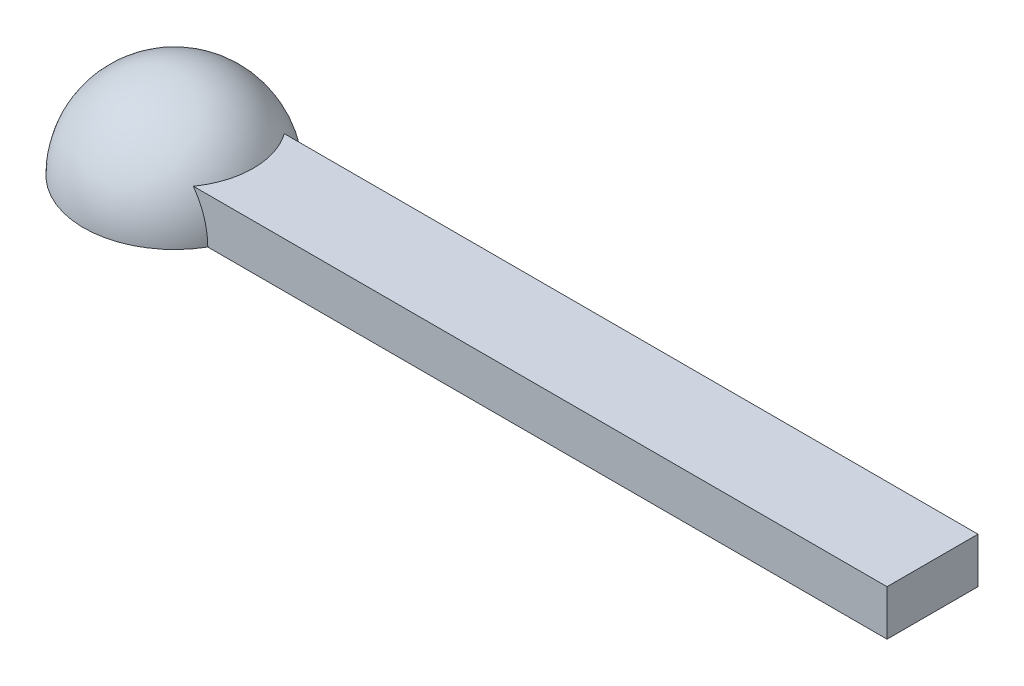
from build123d import *

# Parameters (mm, degrees)
REVOLVE1_ANGLE                  = 180
BOSS_EXTRUDE1_REACH             = 20.111
BOSS_EXTRUDE1_END_RADIUS        = 6
SKETCH2_W                       = 6
SKETCH2_H                       = 3
BOSS_EXTRUDE1_DIRECTION_2_DEPTH = 40


with BuildPart() as part:
    # Sketch1 → Revolve1 (revolve)
    with BuildSketch(Plane(origin=(0, 0, 0), x_dir=(1, 0, 0), z_dir=(0, 1, 0))):
        with BuildLine():
            Line((-6, 0), (-5, 0))
            ThreePointArc((-5, 0), (0, 5), (5, 0))
            Line((5, 0), (6, 0))
            ThreePointArc((6, 0), (0, 6), (-6, 0))
        make_face()
    revolve(axis=Axis((-6, 0, 0), (1, 0, 0)), revolution_arc=REVOLVE1_ANGLE)

    # Boss-Extrude1: up to this sphere (the profile starts outside it)
    boss_extrude1_end = Location((0, 0, 0)) * Sphere(BOSS_EXTRUDE1_END_RADIUS, mode=Mode.PRIVATE)
    # Sketch2 → Boss-Extrude1 (add, up to the surface)
    with BuildSketch(Plane(origin=(10, 0, 0), x_dir=(0, 0, -1), z_dir=(1, 0, 0)), mode=Mode.PRIVATE) as boss_extrude1_sk1:
        with Locations((0, 1.5)):
            Rectangle(SKETCH2_W, SKETCH2_H)
    boss_extrude1_tool1 = extrude(boss_extrude1_sk1.sketch, amount=-BOSS_EXTRUDE1_REACH, mode=Mode.PRIVATE) - boss_extrude1_end
    add(boss_extrude1_tool1.solids().sort_by_distance((10, 1.5, 0))[0])

    # Sketch2 → Boss-Extrude1 direction 2 (add)
    with BuildSketch(Plane(origin=(10, 0, 0), x_dir=(0, 0, -1), z_dir=(1, 0, 0))):
        with Locations((0, 1.5)):
            Rectangle(SKETCH2_W, SKETCH2_H)
    extrude(amount=BOSS_EXTRUDE1_DIRECTION_2_DEPTH)


solid = part.part
